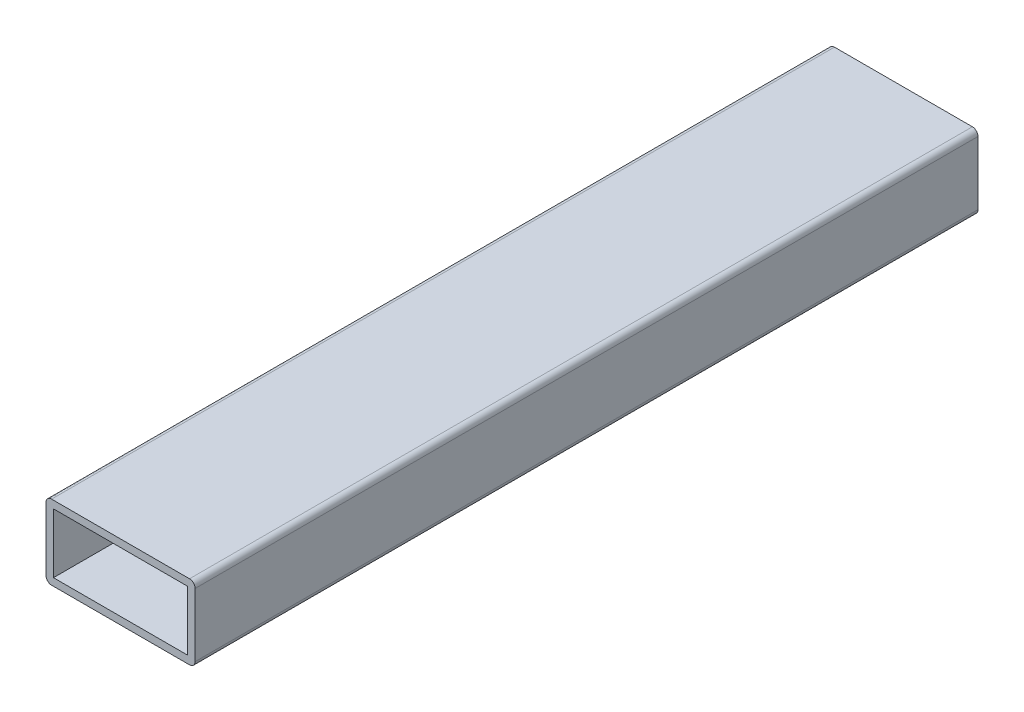
from build123d import *

# Parameters (mm, degrees)
Y_KSEKLIK_EKSTR_ZYON1_DEPTH      = 210
Y_KSEKLIK_EKSTR_ZYON1_DEPTH_BACK = 210
IZIM1_W                          = 72
IZIM1_H                          = 32


with BuildPart() as part:
    # Çizim1 → Yükseklik-Ekstrüzyon1 (new, two sides: drawn at the far end of the back side and taken through both)
    with BuildSketch(Plane.XY.offset(-Y_KSEKLIK_EKSTR_ZYON1_DEPTH_BACK)):
        with BuildLine():
            Line((-37, 20), (37, 20))
            ThreePointArc((37, 20), (39.121320344, 19.121320344), (40, 17))
            Line((40, 17), (40, -17))
            ThreePointArc((40, -17), (39.121320344, -19.121320344), (37, -20))
            Line((37, -20), (-37, -20))
            ThreePointArc((-37, -20), (-39.121320344, -19.121320344), (-40, -17))
            Line((-40, -17), (-40, 17))
            ThreePointArc((-40, 17), (-39.121320344, 19.121320344), (-37, 20))
        make_face()
        Rectangle(IZIM1_W, IZIM1_H, mode=Mode.SUBTRACT)
    extrude(amount=Y_KSEKLIK_EKSTR_ZYON1_DEPTH + Y_KSEKLIK_EKSTR_ZYON1_DEPTH_BACK)


solid = part.part
